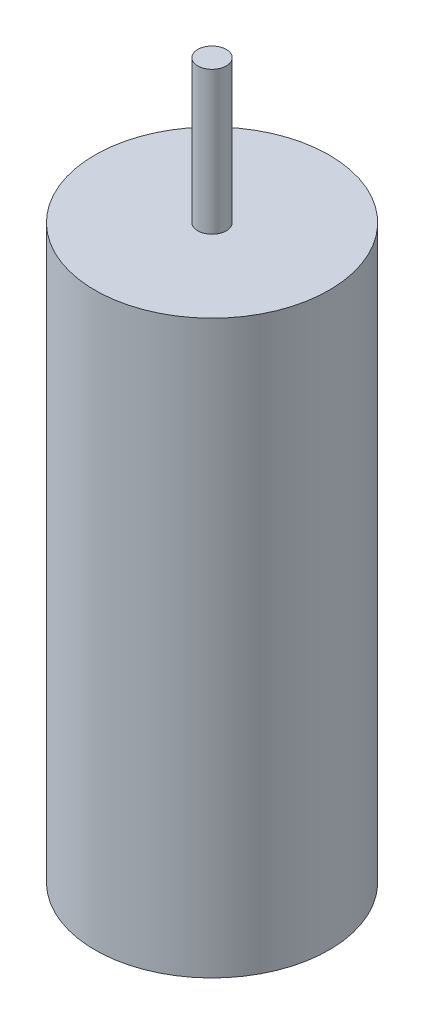
from build123d import *


with BuildPart() as part:
    # Esboço1 → Revolução1 (revolve)
    with BuildSketch(Plane.XY, mode=Mode.PRIVATE) as revolu_o1_sk:
        Polygon((0, 25), (0.5, 25), (0.5, 20), (4.1, 20), (4.1, 0), (0, 0), align=None)
    revolve(revolu_o1_sk.sketch.rotate(Axis((0, 0, 0), (0, 1, 0)), 90), axis=Axis((0, 0, 0), (0, 1, 0)))


solid = part.part
